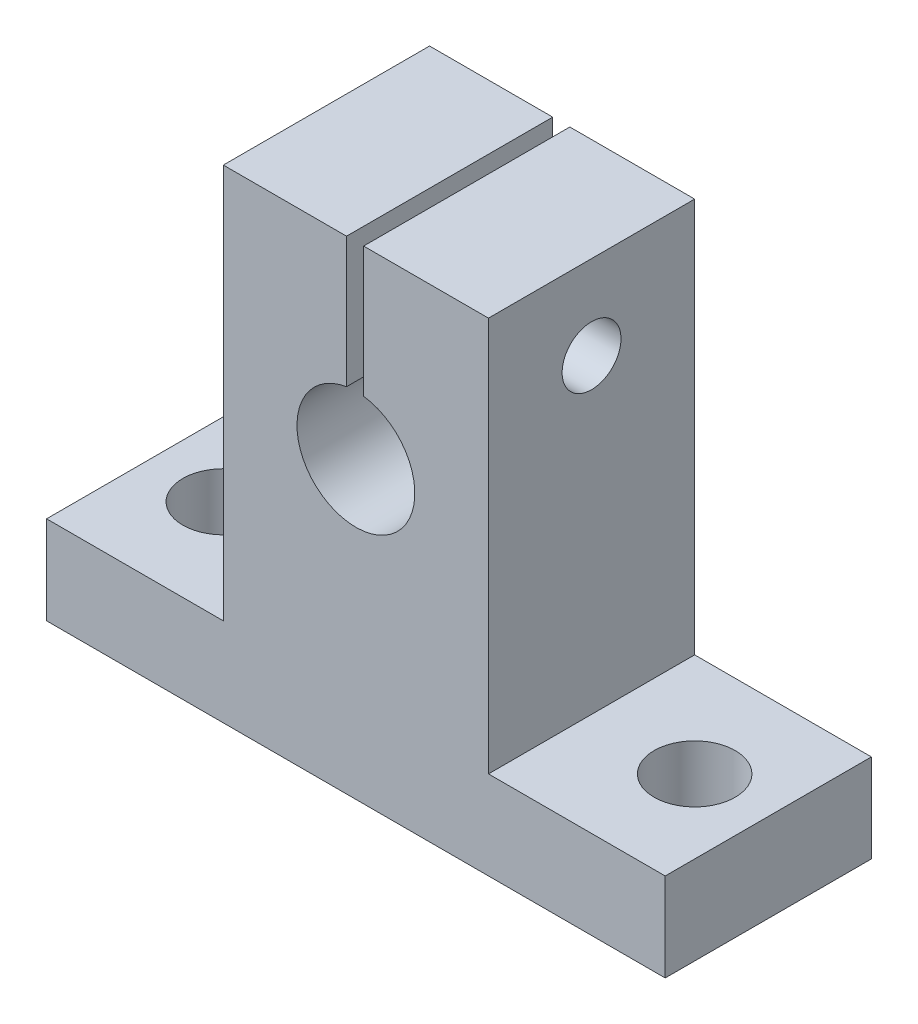
from build123d import *

# Parameters (mm, degrees)
SKETCH_1_W          = 42
SKETCH_1_H          = 14
EXTRUDE_1_DEPTH     = 6
SKETCH_2_R          = 2.75
CUT_EXTRUDE_1_DEPTH = 30.423076981
SKETCH_3_W          = 18
SKETCH_3_H          = 14
EXTRUDE_2_DEPTH     = 26.8
SKETCH_4_R          = 4
CUT_EXTRUDE_2_DEPTH = 46.121439209
SKETCH_5_W          = 1.161233153
SKETCH_5_H          = 8.851007199
CUT_EXTRUDE_3_DEPTH = 46.121439209
SKETCH_7_R          = 2
CUT_EXTRUDE_4_DEPTH = 46.182443302


with BuildPart() as part:
    # 草图1 → 凸台-拉伸1 (new body)
    with BuildSketch(Plane(origin=(0, 0, 0), x_dir=(1, 0, 0), z_dir=(0, 1, 0))):
        with Locations((6.642436149, -1.100196464)):
            Rectangle(SKETCH_1_W, SKETCH_1_H)
    extrude(amount=EXTRUDE_1_DEPTH)

    # 草图2 → 切除-拉伸1 (cut, through all)
    with BuildSketch(Plane(origin=(0, 6, 0), x_dir=(1, 0, 0), z_dir=(0, 1, 0))):
        with Locations(Location((-9.357563851, -1.100196464, 0), (0, 0, 270))):
            Circle(SKETCH_2_R)
        with Locations(Location((22.642436149, -1.100196464, 0), (0, 0, 270))):
            Circle(SKETCH_2_R)
    extrude(amount=-CUT_EXTRUDE_1_DEPTH, mode=Mode.SUBTRACT)

    # 草图3 → 凸台-拉伸2 (add)
    with BuildSketch(Plane(origin=(0, 6, 0), x_dir=(1, 0, 0), z_dir=(0, 1, 0))):
        with Locations((6.642436149, -1.100196464)):
            Rectangle(SKETCH_3_W, SKETCH_3_H)
    extrude(amount=EXTRUDE_2_DEPTH)

    # 草图4 → 切除-拉伸2 (cut, through all)
    with BuildSketch(Plane.XY.offset(8.100196464)):
        with Locations((6.642436149, 20)):
            Circle(SKETCH_4_R)
    extrude(amount=-CUT_EXTRUDE_2_DEPTH, mode=Mode.SUBTRACT)

    # 草图5 → 切除-拉伸3 (cut, through all)
    with BuildSketch(Plane(origin=(0, 0, -5.899803536), x_dir=(-1, 0, 0), z_dir=(0, 0, -1))):
        with Locations((-6.586298571, 28.374496401)):
            Rectangle(SKETCH_5_W, SKETCH_5_H)
    extrude(amount=-CUT_EXTRUDE_3_DEPTH, mode=Mode.SUBTRACT)

    # 草图7 → 切除-拉伸4 (cut, through all)
    with BuildSketch(Plane.ZY.offset(2.357563851)):
        with Locations((1.100196464, 27.091605966)):
            Circle(SKETCH_7_R)
    extrude(amount=-CUT_EXTRUDE_4_DEPTH, mode=Mode.SUBTRACT)


solid = part.part
